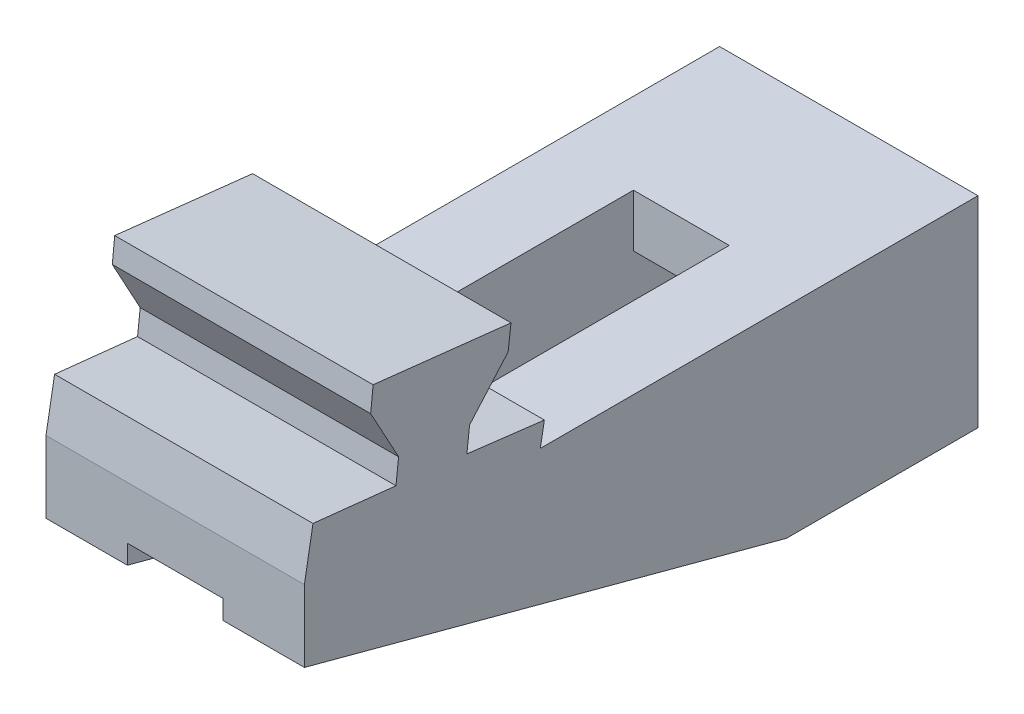
from build123d import *

# Parameters (mm, degrees)
SKETCH1_W           = 54
SKETCH1_H           = 42
BOSS_EXTRUDE1_DEPTH = 40
BOSS_EXTRUDE2_DEPTH = 54
SKETCH12_W          = 20
SKETCH12_H          = 65.765371804
CUT_EXTRUDE5_DEPTH  = 157.508433956
SKETCH13_W          = 20
SKETCH13_H          = 20
CUT_EXTRUDE6_DEPTH  = 157.508433956
SKETCH14_W          = 7.9
SKETCH14_H          = 7.9
CUT_EXTRUDE7_DEPTH  = 20.2
BOSS_EXTRUDE3_DEPTH = 54
CUT_EXTRUDE8_DEPTH  = 54


with BuildPart() as part:
    # Sketch1 → Boss-Extrude1 (new body)
    with BuildSketch(Plane.XY):
        with Locations((27, 21)):
            Rectangle(SKETCH1_W, SKETCH1_H)
    extrude(amount=BOSS_EXTRUDE1_DEPTH)

    # Sketch5 → Boss-Extrude2 (add)
    with BuildSketch(Plane.ZY):
        Polygon((140.765371804, 42), (40, 42), (40, 0), (140.765371804, 27), align=None)
    extrude(amount=-BOSS_EXTRUDE2_DEPTH)

    # Sketch12 → Cut-Extrude5 (cut, through all)
    with BuildSketch(Plane(origin=(0, 42, 0), x_dir=(1, 0, 0), z_dir=(0, 1, 0))):
        with Locations((27, -67.882685902)):
            Rectangle(SKETCH12_W, SKETCH12_H)
    extrude(amount=-CUT_EXTRUDE5_DEPTH, mode=Mode.SUBTRACT)

    # Sketch13 → Cut-Extrude6 (cut, through all)
    with BuildSketch(Plane(origin=(0, 0, 0), x_dir=(-1, 0, 0), z_dir=(0, 0, -1))):
        with Locations((-27, 21)):
            Rectangle(SKETCH13_W, SKETCH13_H)
    extrude(amount=-CUT_EXTRUDE6_DEPTH, mode=Mode.SUBTRACT)

    # Sketch14 → Cut-Extrude7 (cut)
    with BuildSketch(Plane(origin=(0, 0, 0), x_dir=(-1, 0, 0), z_dir=(0, 0, -1))):
        with Locations((-45.25, 33.25)):
            Rectangle(SKETCH14_W, SKETCH14_H)
        with Locations((-45.25, 8.75)):
            Rectangle(SKETCH14_W, SKETCH14_H)
        with Locations((-8.75, 33.25)):
            Rectangle(SKETCH14_W, SKETCH14_H)
        with Locations((-8.75, 8.75)):
            Rectangle(SKETCH14_W, SKETCH14_H)
    extrude(amount=-CUT_EXTRUDE7_DEPTH, mode=Mode.SUBTRACT)

    # Sketch16 → Boss-Extrude3 (add)
    with BuildSketch(Plane(origin=(54, 0, 0), x_dir=(0, 0, -1), z_dir=(1, 0, 0))):
        Polygon((-140.765371804, 42), (-135.475562383, 72), (-87.112319758, 66.620193825), (-91.4535242, 42), align=None)
    extrude(amount=-BOSS_EXTRUDE3_DEPTH)

    # Sketch18 → Cut-Extrude8 (cut)
    with BuildSketch(Plane(origin=(54, 0, 0), x_dir=(0, 0, -1), z_dir=(1, 0, 0))):
        Polygon((-126.406728237, 70.991205567), (-135.475562383, 72), (-138.97204162, 52.170480871), (-121.632853281, 50.323309926), (-121.080075246, 55.292659626), (-126.9167299, 66.017283743), align=None)
        Polygon((-97.584499975, 67.785092966), (-98.201251534, 62.823277017), (-106.251724868, 53.643191009), (-106.804502902, 48.673841309), (-90.622534666, 46.712775836), (-87.112319758, 66.620193825), align=None)
    extrude(amount=-CUT_EXTRUDE8_DEPTH, mode=Mode.SUBTRACT)


solid = part.part
